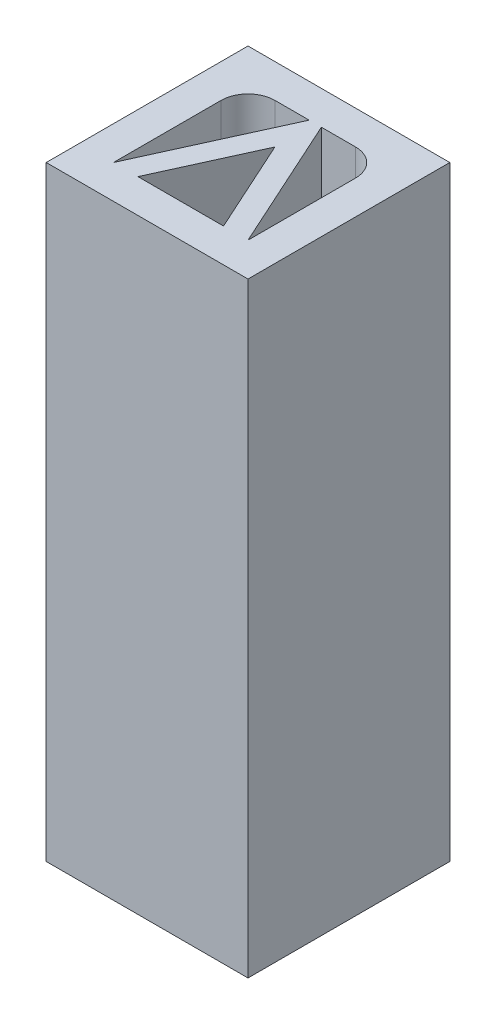
from build123d import *

# Parameters (mm, degrees)
SKETCH1_W           = 15
SKETCH1_H           = 15
SKETCH1_W_2         = 10
SKETCH1_H_2         = 10
BOSS_EXTRUDE1_DEPTH = 45
BOSS_EXTRUDE4_DEPTH = 45
FILLET2_R           = 2


with BuildPart() as part:
    # Sketch1 → Boss-Extrude1 (new body)
    with BuildSketch(Plane(origin=(0, 0, 0), x_dir=(1, 0, 0), z_dir=(0, 1, 0))):
        with Locations((7.5, 7.5)):
            Rectangle(SKETCH1_W, SKETCH1_H)
        with Locations((7.5, 7.5)):
            Rectangle(SKETCH1_W_2, SKETCH1_H_2, mode=Mode.SUBTRACT)
    extrude(amount=BOSS_EXTRUDE1_DEPTH)

    # Sketch3 → Boss-Extrude4 (add, through all)
    with BuildSketch(Plane.XZ):
        Polygon((12.5, -2.5), (7.5, -13.5), (2.5, -2.5), (4.318181818, -2.5), (7.5, -9.5), (10.681818182, -2.5), align=None)
    extrude(amount=-BOSS_EXTRUDE4_DEPTH)

    # Fillet2
    fillet2_edges = [part.edges().sort_by_distance(p)[0] for p in [
        (2.5, 22.5, -12.5),
        (12.5, 22.5, -12.5),
    ]]
    fillet(fillet2_edges, radius=FILLET2_R)


solid = part.part
